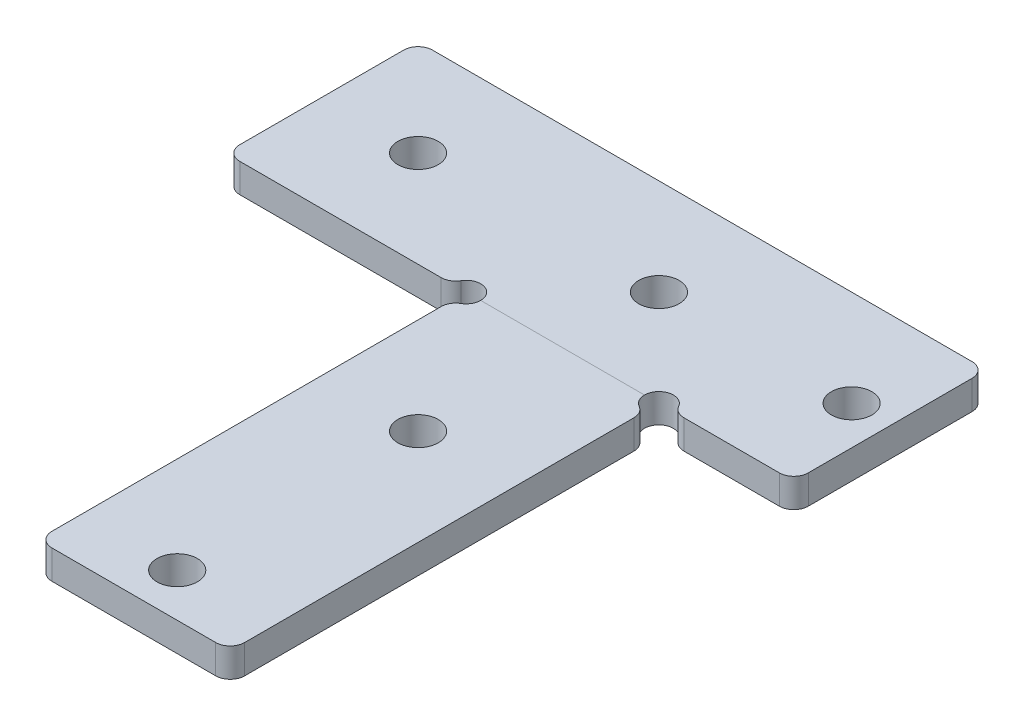
from build123d import *

# Parameters (mm, degrees)
SKETCH_1_R          = 2.1
EXTRUDE_1_DEPTH     = 3
SKETCH_2_W          = 20
SKETCH_2_H          = 5.5
CUT_EXTRUDE_1_DEPTH = 3
SKETCH_3_R          = 1.5
CUT_EXTRUDE_3_DEPTH = 3
FILLET_2_R          = 1.5


with BuildPart() as part:
    # 草图1 → 凸台-拉伸1 (new body)
    with BuildSketch(Plane(origin=(0, 0, 0), x_dir=(1, 0, 0), z_dir=(0, 1, 0))):
        Polygon((-35, 10), (24, 10), (24, -10), (10, -10), (10, -60), (-10, -60), (-10, -10), (-35, -10), align=None)
        with Locations(Location((0, 0, 0), (0, 0, 270))):
            Circle(SKETCH_1_R, mode=Mode.SUBTRACT)
        with Locations(Location((20, 0, 0), (0, 0, 270))):
            Circle(SKETCH_1_R, mode=Mode.SUBTRACT)
        with Locations(Location((-25, 0, 0), (0, 0, 270))):
            Circle(SKETCH_1_R, mode=Mode.SUBTRACT)
        with Locations(Location((0, -25, 0), (0, 0, 270))):
            Circle(SKETCH_1_R, mode=Mode.SUBTRACT)
        with Locations(Location((0, -50, 0), (0, 0, 270))):
            Circle(SKETCH_1_R, mode=Mode.SUBTRACT)
    extrude(amount=EXTRUDE_1_DEPTH)

    # 草图2 → 切除-拉伸1 (cut)
    with BuildSketch(Plane(origin=(0, 3, 0), x_dir=(1, 0, 0), z_dir=(0, 1, 0))):
        with Locations((0, -57.25)):
            Rectangle(SKETCH_2_W, SKETCH_2_H)
    extrude(amount=-CUT_EXTRUDE_1_DEPTH, mode=Mode.SUBTRACT)

    # 草图3 → 切除-拉伸3 (cut)
    with BuildSketch(Plane(origin=(0, 3, 0), x_dir=(1, 0, 0), z_dir=(0, 1, 0))):
        with Locations((10, -10)):
            Circle(SKETCH_3_R)
        with Locations((-10, -10)):
            Circle(SKETCH_3_R)
    extrude(amount=-CUT_EXTRUDE_3_DEPTH, mode=Mode.SUBTRACT)

    # 圆角2
    fillet_2_edges = [part.edges().sort_by_distance(p)[0] for p in [
        (-35, 1.5, 10),
        (-35, 1.5, -10),
        (24, 1.5, -10),
        (24, 1.5, 10),
        (-10, 1.5, 54.5),
        (10, 1.5, 54.5),
        (11.5, 1.5, 10),
        (-10, 1.5, 11.5),
        (10, 1.5, 11.5),
        (-11.5, 1.5, 10),
    ]]
    fillet(fillet_2_edges, radius=FILLET_2_R)


solid = part.part
